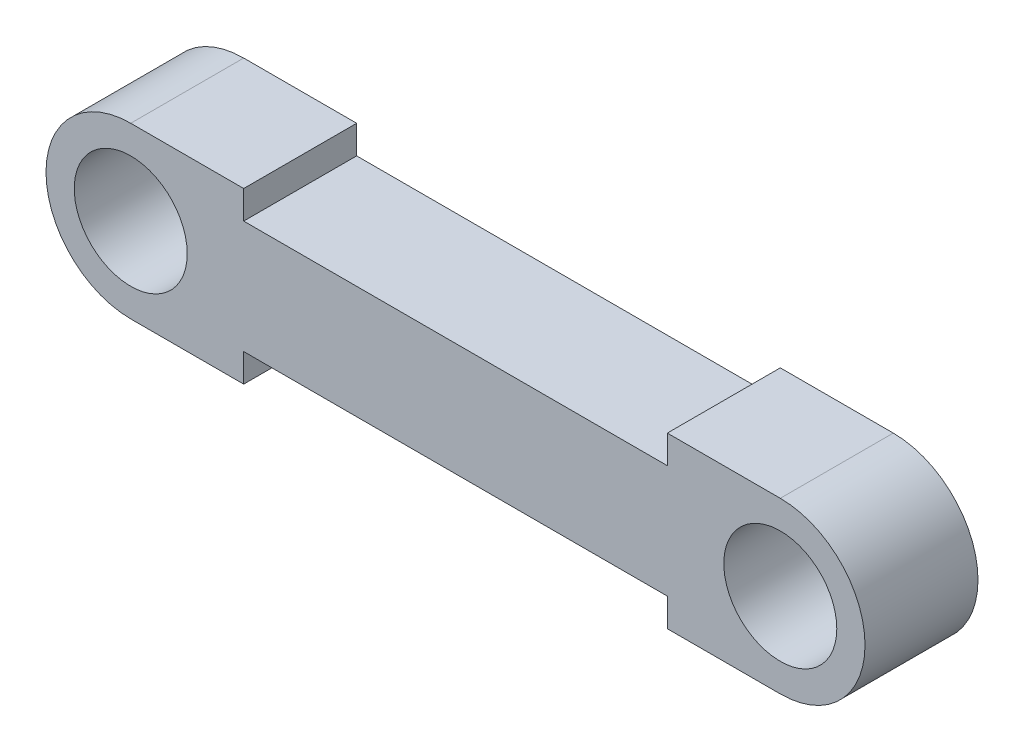
from build123d import *

# Parameters (mm, degrees)
SKETCH_1_R      = 2
EXTRUDE_1_DEPTH = 2


with BuildPart() as part:
    # 草图1 → 凸台-拉伸1 (new, symmetric)
    with BuildSketch(Plane.XY):
        with BuildLine():
            Line((0, 3), (4, 3))
            Line((4, 3), (4, 2))
            Line((4, 2), (19, 2))
            Line((19, 2), (19, 3))
            Line((19, 3), (23, 3))
            ThreePointArc((23, 3), (26, 0), (23, -3))
            Line((23, -3), (19, -3))
            Line((19, -3), (19, -2))
            Line((19, -2), (4, -2))
            Line((4, -2), (4, -3))
            Line((4, -3), (0, -3))
            ThreePointArc((0, -3), (-3, 0), (0, 3))
        make_face()
        Circle(SKETCH_1_R, mode=Mode.SUBTRACT)
        with Locations((23, 0)):
            Circle(SKETCH_1_R, mode=Mode.SUBTRACT)
    extrude(amount=EXTRUDE_1_DEPTH, both=True)


solid = part.part
